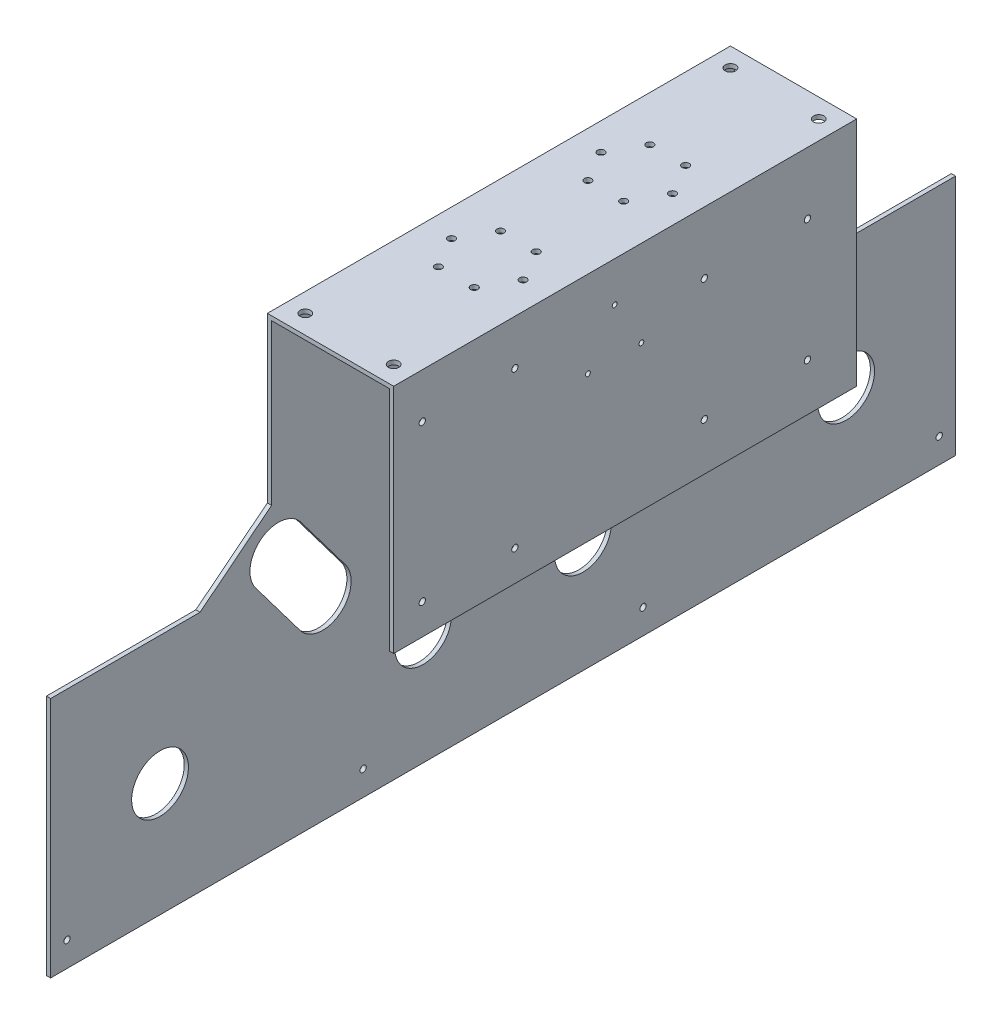
from build123d import *

# Parameters (mm, degrees)
BOSS_EXTRUDE1_DEPTH = 220
SKETCH2_R           = 1.7
CUT_EXTRUDE2_DEPTH  = 2
SKETCH3_R           = 1.15
CUT_EXTRUDE4_DEPTH  = 10
SKETCH4_R           = 1.5
CUT_EXTRUDE5_DEPTH  = 10
BOSS_EXTRUDE2_DEPTH = 2
SKETCH8_R           = 13.5
SKETCH8_R_2         = 1.5
CUT_EXTRUDE6_DEPTH  = 2
SKETCH9_R           = 2.5
CUT_EXTRUDE7_DEPTH  = 10


with BuildPart() as part:
    # Sketch1 → Boss-Extrude1 (new body)
    with BuildSketch(Plane.XY):
        Polygon((-58, -2), (-2, -2), (-2, -110), (0, -110), (0, 0), (-60, 0), (-60, -220), (-58, -220), align=None)
    extrude(amount=BOSS_EXTRUDE1_DEPTH)

    # Sketch2 → Cut-Extrude2 (cut)
    with BuildSketch(Plane(origin=(0, 0, 0), x_dir=(1, 0, 0), z_dir=(0, 1, 0))):
        with Locations(Location((-38.5, -59.777568136, 0), (0, 0, 270))):
            Circle(SKETCH2_R)
        with Locations(Location((-21.5, -59.777568136, 0), (0, 0, 270))):
            Circle(SKETCH2_R)
        with Locations(Location((-13, -74.5, 0), (0, 0, 270))):
            Circle(SKETCH2_R)
        with Locations(Location((-21.5, -89.222431864, 0), (0, 0, 270))):
            Circle(SKETCH2_R)
        with Locations(Location((-38.5, -89.222431864, 0), (0, 0, 270))):
            Circle(SKETCH2_R)
        with Locations(Location((-47, -74.5, 0), (0, 0, 270))):
            Circle(SKETCH2_R)
        with Locations(Location((-38.5, -130.777568136, 0), (0, 0, 270))):
            Circle(SKETCH2_R)
        with Locations(Location((-47, -145.5, 0), (0, 0, 270))):
            Circle(SKETCH2_R)
        with Locations(Location((-38.5, -160.222431864, 0), (0, 0, 270))):
            Circle(SKETCH2_R)
        with Locations(Location((-21.5, -160.222431864, 0), (0, 0, 270))):
            Circle(SKETCH2_R)
        with Locations(Location((-13, -145.5, 0), (0, 0, 270))):
            Circle(SKETCH2_R)
        with Locations(Location((-21.5, -130.777568136, 0), (0, 0, 270))):
            Circle(SKETCH2_R)
    extrude(amount=-CUT_EXTRUDE2_DEPTH, mode=Mode.SUBTRACT)

    # Sketch3 → Cut-Extrude4 (cut)
    with BuildSketch(Plane(origin=(0, 0, 0), x_dir=(0, 0, -1), z_dir=(1, 0, 0))):
        with Locations((-115, -19.001477372)):
            Circle(SKETCH3_R)
        with Locations((-127.7, -40.998522628)):
            Circle(SKETCH3_R)
        with Locations((-102.3, -40.998522628)):
            Circle(SKETCH3_R)
    extrude(amount=-CUT_EXTRUDE4_DEPTH, mode=Mode.SUBTRACT)

    # Sketch4 → Cut-Extrude5 (cut)
    with BuildSketch(Plane(origin=(0, 0, 0), x_dir=(0, 0, -1), z_dir=(1, 0, 0))):
        with Locations((-206.39781016, -21.433290156)):
            Circle(SKETCH4_R)
        with Locations((-162.39781016, -21.433290156)):
            Circle(SKETCH4_R)
        with Locations((-206.39781016, -95.433290156)):
            Circle(SKETCH4_R)
        with Locations((-162.39781016, -95.433290156)):
            Circle(SKETCH4_R)
        with Locations((-72.39781016, -29.433290156)):
            Circle(SKETCH4_R)
        with Locations((-23.39781016, -29.433290156)):
            Circle(SKETCH4_R)
        with Locations((-72.39781016, -87.433290156)):
            Circle(SKETCH4_R)
        with Locations((-23.39781016, -87.433290156)):
            Circle(SKETCH4_R)
    extrude(amount=-CUT_EXTRUDE5_DEPTH, mode=Mode.SUBTRACT)

    # Sketch6 → Boss-Extrude2 (add)
    with BuildSketch(Plane.ZY.offset(60)):
        Polygon((0, -78), (-34, -105), (-105, -105), (-105, -220), (0, -220), align=None)
        Polygon((220, -78), (220, -220), (325, -220), (325, -105), (254, -105), align=None)
    extrude(amount=-BOSS_EXTRUDE2_DEPTH)

    # Sketch8 → Cut-Extrude6 (cut)
    with BuildSketch(Plane.ZY.offset(60)):
        with Locations(Location((-53, -166, 0), (0, 0, 270))):
            Circle(SKETCH8_R)
        with Locations(Location((72, -166, 0), (0, 0, 270))):
            Circle(SKETCH8_R)
        with Locations(Location((148, -166, 0), (0, 0, 90))):
            Circle(SKETCH8_R)
        with Locations(Location((273, -166, 0), (0, 0, 90))):
            Circle(SKETCH8_R)
        with Locations(Location((-97.2, -208.2, 0), (0, 0, 270))):
            Circle(SKETCH8_R_2)
        with Locations(Location((43.5, -208.2, 0), (0, 0, 270))):
            Circle(SKETCH8_R_2)
        with Locations(Location((176.5, -208.2, 0), (0, 0, 90))):
            Circle(SKETCH8_R_2)
        with Locations(Location((317.2, -208.2, 0), (0, 0, 90))):
            Circle(SKETCH8_R_2)
        with Locations(Location((71.99, -66.8, 0), (0, 0, 270))):
            Circle(SKETCH8_R)
        with Locations(Location((148.01, -66.8, 0), (0, 0, 90))):
            Circle(SKETCH8_R)
        with BuildLine():
            Line((-7.563158771, -108.249005625), (13.500367039, -136.201248477))
            ThreePointArc((13.500367039, -136.201248477), (32.406449237, -138.85832505), (35.06352581, -119.952242852))
            Line((35.06352581, -119.952242852), (14, -92))
            ThreePointArc((14, -92), (-4.906082198, -89.342923427), (-7.563158771, -108.249005625))
        make_face()
        with BuildLine():
            Line((206, -92), (184.93647419, -119.952242852))
            ThreePointArc((184.93647419, -119.952242852), (187.593550763, -138.85832505), (206.499632961, -136.201248477))
            Line((206.499632961, -136.201248477), (227.563158771, -108.249005625))
            ThreePointArc((227.563158771, -108.249005625), (224.906082198, -89.342923427), (206, -92))
        make_face()
    extrude(amount=-CUT_EXTRUDE6_DEPTH, mode=Mode.SUBTRACT)

    # Sketch9 → Cut-Extrude7 (cut)
    with BuildSketch(Plane(origin=(0, 0, 0), x_dir=(1, 0, 0), z_dir=(0, 1, 0))):
        with Locations(Location((-51, -9, 0), (0, 0, 180))):
            Circle(SKETCH9_R)
        with Locations(Location((-9, -9, 0), (0, 0, 180))):
            Circle(SKETCH9_R)
        with Locations(Location((-9, -211, 0), (0, 0, 180))):
            Circle(SKETCH9_R)
        with Locations(Location((-51, -211, 0), (0, 0, 180))):
            Circle(SKETCH9_R)
    extrude(amount=-CUT_EXTRUDE7_DEPTH, mode=Mode.SUBTRACT)


solid = part.part
